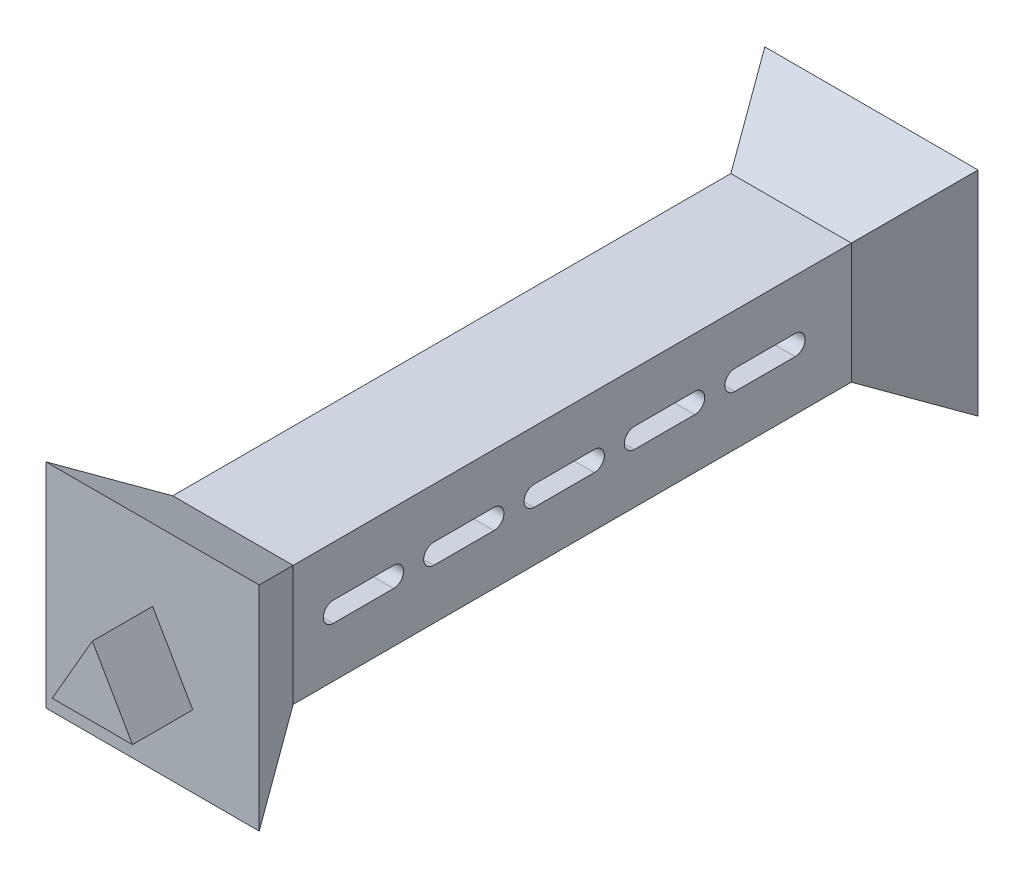
from build123d import *

# Parameters (mm, degrees)
SKETCH1_W               = 3
SKETCH1_H               = 3
BOSS_EXTRUDE1_DEPTH     = 13.9
SKETCH2_W               = 3
SKETCH2_H               = 3
BOSS_EXTRUDE2_DEPTH     = 2
BOSS_EXTRUDE2_DRAFT     = -30
MIRROR1_COPY_1_SKETCH_W = 3
MIRROR1_COPY_1_SKETCH_H = 3
MIRROR1_COPY_1_DEPTH    = 2
MIRROR1_COPY_1_DRAFT    = -30
BOSS_EXTRUDE3_DEPTH     = 1.5
CUT_EXTRUDE1_REACH      = 20.085


with BuildPart() as part:
    # Sketch1 → Boss-Extrude1 (new body)
    with BuildSketch(Plane.XY):
        Rectangle(SKETCH1_W, SKETCH1_H)
    extrude(amount=BOSS_EXTRUDE1_DEPTH)


with BuildPart() as boss_extrude2_tool:
    # Sketch2 → Boss-Extrude2 (with draft: the straight prism first)
    with BuildSketch(Plane.XY.offset(13.9)):
        Rectangle(SKETCH2_W, SKETCH2_H)
    extrude(amount=BOSS_EXTRUDE2_DEPTH)
    # Boss-Extrude2: the draft: its side faces are tilted about the plane it starts from
    boss_extrude2_sides = [boss_extrude2_tool.faces().sort_by_distance(p)[0] for p in [
        (1.5, 0, 14.9),
        (0, 1.5, 14.9),
        (-1.5, 0, 14.9),
        (0, -1.5, 14.9),
    ]]
    draft(boss_extrude2_sides, Plane.XY.offset(13.9), BOSS_EXTRUDE2_DRAFT)


with BuildPart() as part_1:
    add(part.part)

    # Boss-Extrude2: add boss_extrude2_tool
    add(boss_extrude2_tool.part)


with BuildPart() as mirror1_copy_1_tool:
    # Mirror1 copy 1 sketch → Mirror1 copy 1 (with draft: the straight prism first)
    with BuildSketch(Plane(origin=(0, 0, 0), x_dir=(1, 0, 0), z_dir=(0, 0, -1))):
        Rectangle(MIRROR1_COPY_1_SKETCH_W, MIRROR1_COPY_1_SKETCH_H)
    extrude(amount=MIRROR1_COPY_1_DEPTH)
    # Mirror1 copy 1: the draft: its side faces are tilted about the plane it starts from
    mirror1_copy_1_sides = [mirror1_copy_1_tool.faces().sort_by_distance(p)[0] for p in [
        (1.5, 0, -1),
        (0, 1.5, -1),
        (-1.5, 0, -1),
        (0, -1.5, -1),
    ]]
    draft(mirror1_copy_1_sides, Plane(origin=(0, 0, 0), x_dir=(1, 0, 0), z_dir=(0, 0, -1)), MIRROR1_COPY_1_DRAFT)


with BuildPart() as part_2:
    add(part_1.part)

    # Mirror1 copy 1: add mirror1_copy_1_tool
    add(mirror1_copy_1_tool.part)

    # Sketch3 → Boss-Extrude3 (add)
    with BuildSketch(Plane.XY.offset(15.9)):
        Polygon((0, 0.866025404), (-1, -0.866025404), (1, -0.866025404), align=None)
    boss_extrude3 = extrude(amount=BOSS_EXTRUDE3_DEPTH)

    # Mirror2: Boss-Extrude3 across plane
    add(boss_extrude3.mirror(Plane.XY.offset(6.95)))

    # Sketch7 → Cut-Extrude1 (cut, up to next)
    with BuildSketch(Plane(origin=(1.5, 0, 0), x_dir=(0, 0, -1), z_dir=(1, 0, 0)), mode=Mode.PRIVATE) as cut_extrude1_sk1:
        with BuildLine():
            Line((-12.9, 0.25), (-11.4, 0.25))
            ThreePointArc((-11.4, 0.25), (-11.15, 0), (-11.4, -0.25))
            Line((-11.4, -0.25), (-12.9, -0.25))
            ThreePointArc((-12.9, -0.25), (-13.15, 0), (-12.9, 0.25))
        make_face()
    cut_extrude1_tool1 = extrude(cut_extrude1_sk1.sketch, amount=-CUT_EXTRUDE1_REACH, mode=Mode.PRIVATE) & part_2.part
    # Sketch7 → Cut-Extrude1 (cut, up to next)
    with BuildSketch(Plane(origin=(1.5, 0, 0), x_dir=(0, 0, -1), z_dir=(1, 0, 0)), mode=Mode.PRIVATE) as cut_extrude1_sk2:
        with BuildLine():
            Line((-10.4, 0.25), (-8.9, 0.25))
            ThreePointArc((-8.9, 0.25), (-8.65, 0), (-8.9, -0.25))
            Line((-8.9, -0.25), (-10.4, -0.25))
            ThreePointArc((-10.4, -0.25), (-10.65, 0), (-10.4, 0.25))
        make_face()
    cut_extrude1_tool2 = extrude(cut_extrude1_sk2.sketch, amount=-CUT_EXTRUDE1_REACH, mode=Mode.PRIVATE) & part_2.part
    # Sketch7 → Cut-Extrude1 (cut, up to next)
    with BuildSketch(Plane(origin=(1.5, 0, 0), x_dir=(0, 0, -1), z_dir=(1, 0, 0)), mode=Mode.PRIVATE) as cut_extrude1_sk3:
        with BuildLine():
            Line((-7.9, 0.25), (-6.4, 0.25))
            ThreePointArc((-6.4, 0.25), (-6.15, 0), (-6.4, -0.25))
            Line((-6.4, -0.25), (-7.9, -0.25))
            ThreePointArc((-7.9, -0.25), (-8.15, 0), (-7.9, 0.25))
        make_face()
    cut_extrude1_tool3 = extrude(cut_extrude1_sk3.sketch, amount=-CUT_EXTRUDE1_REACH, mode=Mode.PRIVATE) & part_2.part
    # Sketch7 → Cut-Extrude1 (cut, up to next)
    with BuildSketch(Plane(origin=(1.5, 0, 0), x_dir=(0, 0, -1), z_dir=(1, 0, 0)), mode=Mode.PRIVATE) as cut_extrude1_sk4:
        with BuildLine():
            Line((-5.4, 0.25), (-3.9, 0.25))
            ThreePointArc((-3.9, 0.25), (-3.65, 0), (-3.9, -0.25))
            Line((-3.9, -0.25), (-5.4, -0.25))
            ThreePointArc((-5.4, -0.25), (-5.65, 0), (-5.4, 0.25))
        make_face()
    cut_extrude1_tool4 = extrude(cut_extrude1_sk4.sketch, amount=-CUT_EXTRUDE1_REACH, mode=Mode.PRIVATE) & part_2.part
    # Sketch7 → Cut-Extrude1 (cut, up to next)
    with BuildSketch(Plane(origin=(1.5, 0, 0), x_dir=(0, 0, -1), z_dir=(1, 0, 0)), mode=Mode.PRIVATE) as cut_extrude1_sk5:
        with BuildLine():
            Line((-2.9, 0.25), (-1.4, 0.25))
            ThreePointArc((-1.4, 0.25), (-1.15, 0), (-1.4, -0.25))
            Line((-1.4, -0.25), (-2.9, -0.25))
            ThreePointArc((-2.9, -0.25), (-3.15, 0), (-2.9, 0.25))
        make_face()
    cut_extrude1_tool5 = extrude(cut_extrude1_sk5.sketch, amount=-CUT_EXTRUDE1_REACH, mode=Mode.PRIVATE) & part_2.part
    add(cut_extrude1_tool1.solids().sort_by_distance((1.5, 0, 12.15))[0], mode=Mode.SUBTRACT)
    add(cut_extrude1_tool2.solids().sort_by_distance((1.5, 0, 9.65))[0], mode=Mode.SUBTRACT)
    add(cut_extrude1_tool3.solids().sort_by_distance((1.5, 0, 7.15))[0], mode=Mode.SUBTRACT)
    add(cut_extrude1_tool4.solids().sort_by_distance((1.5, 0, 4.65))[0], mode=Mode.SUBTRACT)
    add(cut_extrude1_tool5.solids().sort_by_distance((1.5, 0, 2.15))[0], mode=Mode.SUBTRACT)


solid = part_2.part
